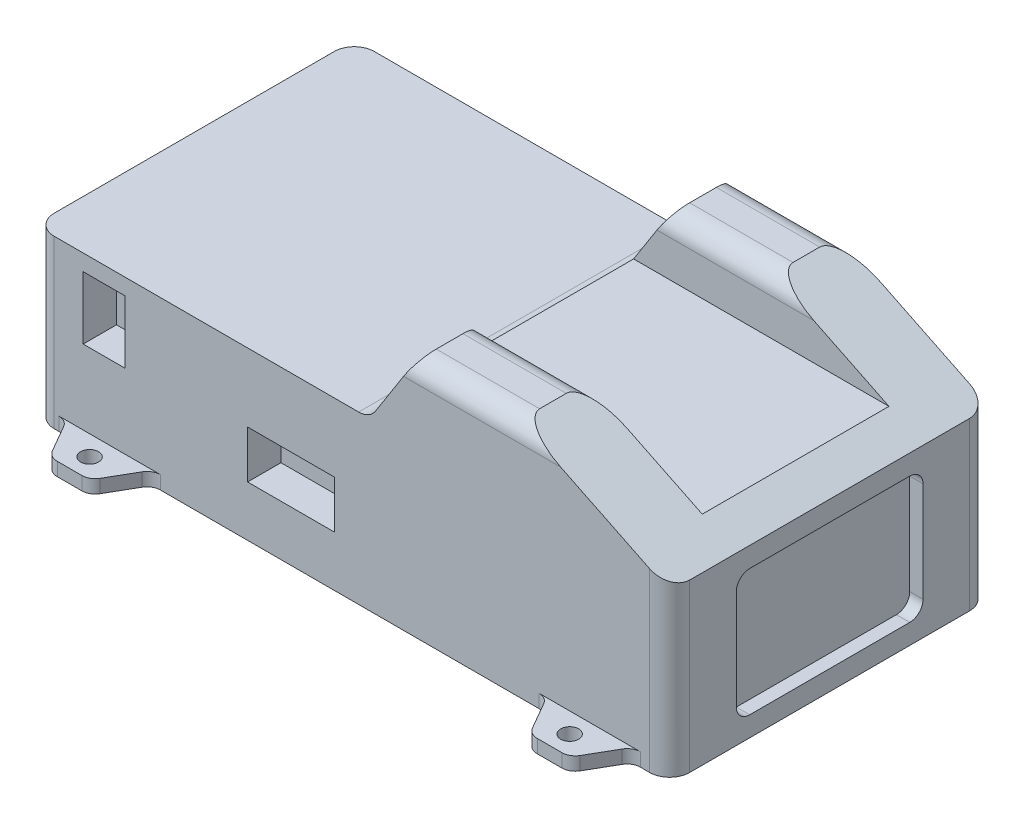
from build123d import *

# Parameters (mm, degrees)
SKETCH_1_W          = 95.3
SKETCH_1_H          = 48
EXTRUDE_1_DEPTH     = 25
EXTRUDE_2_DEPTH     = 45
CUT_EXTRUDE_1_DEPTH = 77.619335027
CUT_EXTRUDE_2_DEPTH = 2
SKETCH_5_R          = 1.35
EXTRUDE_3_DEPTH     = 2
FILLET_1_R          = 2
FILLET_2_R          = 3
SKETCH_6_R          = 3.2
EXTRUDE_4_DEPTH     = 6
SKETCH_7_W          = 13
SKETCH_7_H          = 7.14
SKETCH_7_W_2        = 6.3
SKETCH_7_H_2        = 9.4
CUT_EXTRUDE_3_DEPTH = 5


with BuildPart() as part:
    # 草图1 → 凸台-拉伸1 (new body)
    with BuildSketch(Plane(origin=(0, 0, 0), x_dir=(1, 0, 0), z_dir=(0, 1, 0))):
        Rectangle(SKETCH_1_W, SKETCH_1_H)
    extrude(amount=EXTRUDE_1_DEPTH)

    # 草图2 → 凸台-拉伸2 (add)
    with BuildSketch(Plane(origin=(47.65, 0, 0), x_dir=(0, 0, -1), z_dir=(1, 0, 0))):
        Polygon((-24, 25), (24, 25), (24, 36), (14, 36), (14, 27.5), (-14, 27.5), (-14, 36), (-24, 36), align=None)
    extrude(amount=-EXTRUDE_2_DEPTH)

    # 草图3 → 切除-拉伸1 (cut, through all)
    with BuildSketch(Plane.XY.offset(24)):
        Polygon((2.65, 25), (2.65, 36), (9.65, 36), align=None)
        Polygon((47.65, 25), (47.65, 36), (25.15, 36), align=None)
    extrude(amount=-CUT_EXTRUDE_1_DEPTH, mode=Mode.SUBTRACT)

    # 草图4 → 切除-拉伸2 (cut)
    with BuildSketch(Plane(origin=(47.65, 0, 0), x_dir=(0, 0, -1), z_dir=(1, 0, 0))):
        with BuildLine():
            Line((-12, 22), (12, 22))
            ThreePointArc((12, 22), (13.414213562, 21.414213562), (14, 20))
            Line((14, 20), (14, 5))
            ThreePointArc((14, 5), (13.414213562, 3.585786438), (12, 3))
            Line((12, 3), (-12, 3))
            ThreePointArc((-12, 3), (-13.414213562, 3.585786438), (-14, 5))
            Line((-14, 5), (-14, 20))
            ThreePointArc((-14, 20), (-13.414213562, 21.414213562), (-12, 22))
        make_face()
    extrude(amount=-CUT_EXTRUDE_2_DEPTH, mode=Mode.SUBTRACT)

    # 草图5 → 凸台-拉伸3 (add)
    # profile 1 of 2: a face of its own
    with BuildSketch(Plane.XZ):
        Polygon((29.185898385, 24), (32.65, 30), (38.65, 30), (42.114101615, 24), align=None)
        with Locations(Location((35.65, 27, 0), (0, 0, 270))):
            Circle(SKETCH_5_R, mode=Mode.SUBTRACT)
    # profile 2 of 2: a face of its own
    with BuildSketch(Plane.XZ):
        Polygon((-42.814101615, 24), (-39.35, 30), (-33.35, 30), (-29.885898385, 24), align=None)
        with Locations(Location((-36.35, 27, 0), (0, 0, 270))):
            Circle(SKETCH_5_R, mode=Mode.SUBTRACT)
    extrude_3 = extrude(amount=-EXTRUDE_3_DEPTH)

    # 镜向1: 凸台-拉伸3 across plane
    add(extrude_3.mirror(Plane.XY))

    # 圆角1
    fillet_1_edges = [part.edges().sort_by_distance(p)[0] for p in [
        (-29.885898385, 1, 24),
        (-42.814101615, 1, 24),
        (-39.35, 1, 30),
        (-33.35, 1, 30),
        (29.185898385, 1, -24),
        (42.114101615, 1, -24),
        (38.65, 1, -30),
        (32.65, 1, -30),
        (-42.814101615, 1, -24),
        (-29.885898385, 1, -24),
        (-33.35, 1, -30),
        (-39.35, 1, -30),
        (42.114101615, 1, 24),
        (29.185898385, 1, 24),
        (32.65, 1, 30),
        (38.65, 1, 30),
    ]]
    fillet(fillet_1_edges, radius=FILLET_1_R)

    # 圆角2
    fillet_2_edges = [part.edges().sort_by_distance(p)[0] for p in [
        (2.65, 25, 0),
        (17.4, 36, -24),
        (17.4, 36, -14),
        (17.4, 36, 14),
        (17.4, 36, 24),
        (47.65, 12.5, 24),
        (47.65, 12.5, -24),
        (-47.65, 12.5, 24),
        (-47.65, 12.5, -24),
    ]]
    fillet(fillet_2_edges, radius=FILLET_2_R)

    # 草图6 → 凸台-拉伸4 (add)
    with BuildSketch(Plane.ZY.offset(47.65)):
        with Locations(Location((-7, 5.783019787, 0), (0, 0, 180))):
            Circle(SKETCH_6_R)
        with Locations(Location((7, 5.783019787, 0), (0, 0, 180))):
            Circle(SKETCH_6_R)
    extrude(amount=EXTRUDE_4_DEPTH)

    # 草图7 → 切除-拉伸3 (cut)
    with BuildSketch(Plane.XY.offset(24)):
        with Locations((-9.15, 11.158)):
            Rectangle(SKETCH_7_W, SKETCH_7_H)
        with Locations((-37.16, 17.87)):
            Rectangle(SKETCH_7_W_2, SKETCH_7_H_2)
    extrude(amount=-CUT_EXTRUDE_3_DEPTH, mode=Mode.SUBTRACT)


solid = part.part
